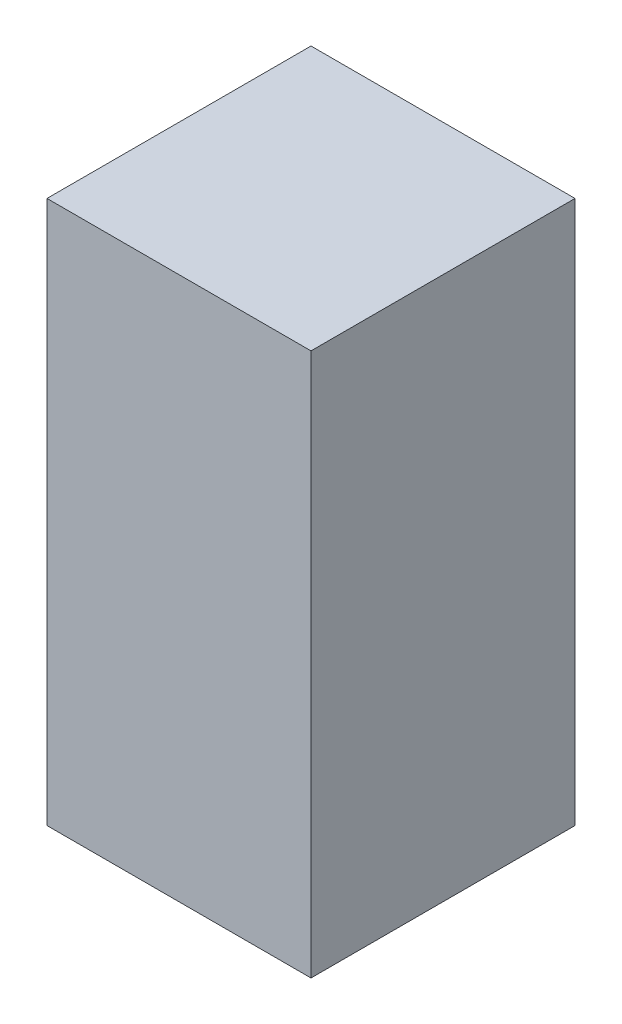
from build123d import *

# Parameters (mm, degrees)
ESQUISSE1_W        = 35
ESQUISSE1_H        = 72
BOSS_EXTRU_1_DEPTH = 35


with BuildPart() as part:
    # Esquisse1 → Boss.-Extru.1 (new body)
    with BuildSketch(Plane.XY):
        Rectangle(ESQUISSE1_W, ESQUISSE1_H)
    extrude(amount=BOSS_EXTRU_1_DEPTH)


solid = part.part
